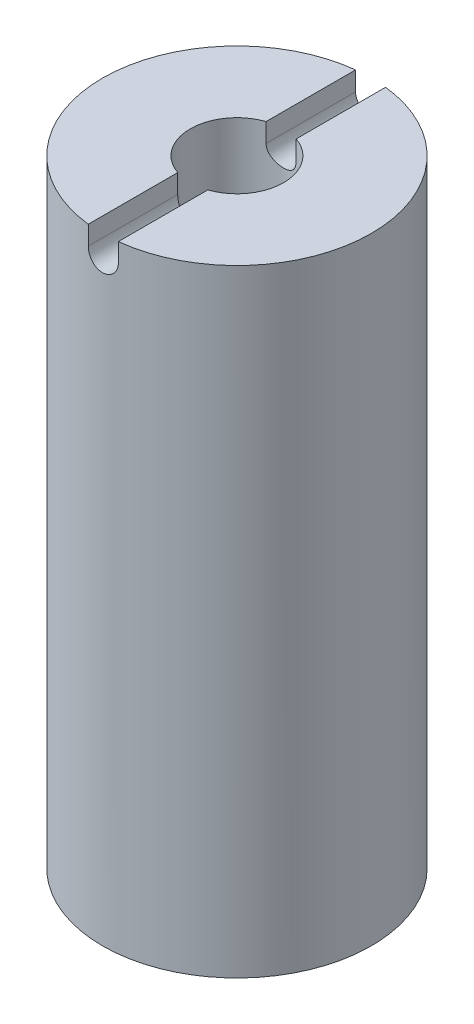
from build123d import *

# Parameters (mm, degrees)
SKETCH1_R               = 8.5
BOSS_EXTRUDE1_DEPTH     = 29
SKETCH2_W               = 5.55
SKETCH2_H               = 10
CUT_EXTRUDE1_DEPTH      = 10
CUT_EXTRUDE1_DEPTH_BACK = 10


with BuildPart() as part:
    # Sketch1 → Boss-Extrude1 (new body)
    with BuildSketch(Plane(origin=(0, 0, 0), x_dir=(1, 0, 0), z_dir=(0, 1, 0))):
        Circle(SKETCH1_R)
        with BuildLine():
            ThreePointArc((5.263897115, 1.76326896), (4.813247893, 0.848705468), (5.549518778, 0.143428015))
            ThreePointArc((5.549518778, 0.143428015), (5.693479971, 0.065679427), (5.749324893, -0.08810943))
            ThreePointArc((5.749324893, -0.08810943), (5.66264458, -0.998477022), (5.432733377, -1.883589143))
            ThreePointArc((5.432733377, -1.883589143), (5.327657428, -2.009003309), (5.165786574, -2.032825456))
            ThreePointArc((5.165786574, -2.032825456), (4.232699161, -2.44375), (4.343371773, -3.457289676))
            ThreePointArc((4.343371773, -3.457289676), (4.403676616, -3.609385021), (4.347602736, -3.763090545))
            ThreePointArc((4.347602736, -3.763090545), (3.696028756, -4.404755548), (2.950967451, -4.935006697))
            ThreePointArc((2.950967451, -4.935006697), (2.789859933, -4.963538005), (2.650547084, -4.877738248))
            ThreePointArc((2.650547084, -4.877738248), (1.671623451, -4.592747684), (1.104912844, -5.440303105))
            ThreePointArc((1.104912844, -5.440303105), (1.053344031, -5.595578104), (0.911588941, -5.677279771))
            ThreePointArc((0.911588941, -5.677279771), (0, -5.75), (-0.911588941, -5.677279771))
            ThreePointArc((-0.911588941, -5.677279771), (-1.053344031, -5.595578104), (-1.104912844, -5.440303105))
            ThreePointArc((-1.104912844, -5.440303105), (-1.671623451, -4.592747684), (-2.650547084, -4.877738248))
            ThreePointArc((-2.650547084, -4.877738248), (-2.789859933, -4.963538005), (-2.950967451, -4.935006697))
            ThreePointArc((-2.950967451, -4.935006697), (-3.696028756, -4.404755548), (-4.347602736, -3.763090545))
            ThreePointArc((-4.347602736, -3.763090545), (-4.403676616, -3.609385021), (-4.343371773, -3.457289676))
            ThreePointArc((-4.343371773, -3.457289676), (-4.232699161, -2.44375), (-5.165786574, -2.032825456))
            ThreePointArc((-5.165786574, -2.032825456), (-5.327657428, -2.009003309), (-5.432733377, -1.883589143))
            ThreePointArc((-5.432733377, -1.883589143), (-5.66264458, -0.998477022), (-5.749324893, -0.08810943))
            ThreePointArc((-5.749324893, -0.08810943), (-5.693479971, 0.065679427), (-5.549518778, 0.143428015))
            ThreePointArc((-5.549518778, 0.143428015), (-4.813247893, 0.848705468), (-5.263897115, 1.76326896))
            ThreePointArc((-5.263897115, 1.76326896), (-5.372584803, 1.885566362), (-5.372462977, 2.049180705))
            ThreePointArc((-5.372462977, 2.049180705), (-4.979646072, 2.875), (-4.460874036, 3.628099066))
            ThreePointArc((-4.460874036, 3.628099066), (-4.319240772, 3.710011742), (-4.158984271, 3.677034144))
            ThreePointArc((-4.158984271, 3.677034144), (-3.141624442, 3.744042216), (-2.898971694, 4.734310233))
            ThreePointArc((-2.898971694, 4.734310233), (-2.903620038, 4.897858577), (-2.798357442, 5.023116127))
            ThreePointArc((-2.798357442, 5.023116127), (-1.966615824, 5.40323257), (-1.08513064, 5.646679688))
            ThreePointArc((-1.08513064, 5.646679688), (-0.923980812, 5.61838833), (-0.822414801, 5.490115132))
            ThreePointArc((-0.822414801, 5.490115132), (0, 4.8875), (0.822414801, 5.490115132))
            ThreePointArc((0.822414801, 5.490115132), (0.923980812, 5.61838833), (1.08513064, 5.646679688))
            ThreePointArc((1.08513064, 5.646679688), (1.966615824, 5.40323257), (2.798357442, 5.023116127))
            ThreePointArc((2.798357442, 5.023116127), (2.903620038, 4.897858577), (2.898971694, 4.734310233))
            ThreePointArc((2.898971694, 4.734310233), (3.141624442, 3.744042216), (4.158984271, 3.677034144))
            ThreePointArc((4.158984271, 3.677034144), (4.319240772, 3.710011742), (4.460874036, 3.628099066))
            ThreePointArc((4.460874036, 3.628099066), (4.979646072, 2.875), (5.372462977, 2.049180705))
            ThreePointArc((5.372462977, 2.049180705), (5.372584803, 1.885566362), (5.263897115, 1.76326896))
        make_face(mode=Mode.SUBTRACT)
    extrude(amount=BOSS_EXTRUDE1_DEPTH)

    # Sketch2 → Revolve2 (revolve)
    with BuildSketch(Plane.XY):
        with Locations((-5.725, 34)):
            Rectangle(SKETCH2_W, SKETCH2_H)
    revolve(axis=Axis((0, 0, 0), (0, 1, 0)))

    # Sketch4 → Cut-Extrude1 (cut, two sides: drawn at the far end of the back side and taken through both)
    with BuildSketch(Plane.XY.offset(-CUT_EXTRUDE1_DEPTH_BACK)):
        with BuildLine():
            Line((-0.95, 37.8), (-0.95, 39))
            Line((-0.95, 39), (0.95, 39))
            Line((0.95, 39), (0.95, 37.8))
            ThreePointArc((0.95, 37.8), (0, 36.85), (-0.95, 37.8))
        make_face()
    extrude(amount=CUT_EXTRUDE1_DEPTH + CUT_EXTRUDE1_DEPTH_BACK, mode=Mode.SUBTRACT)


solid = part.part
